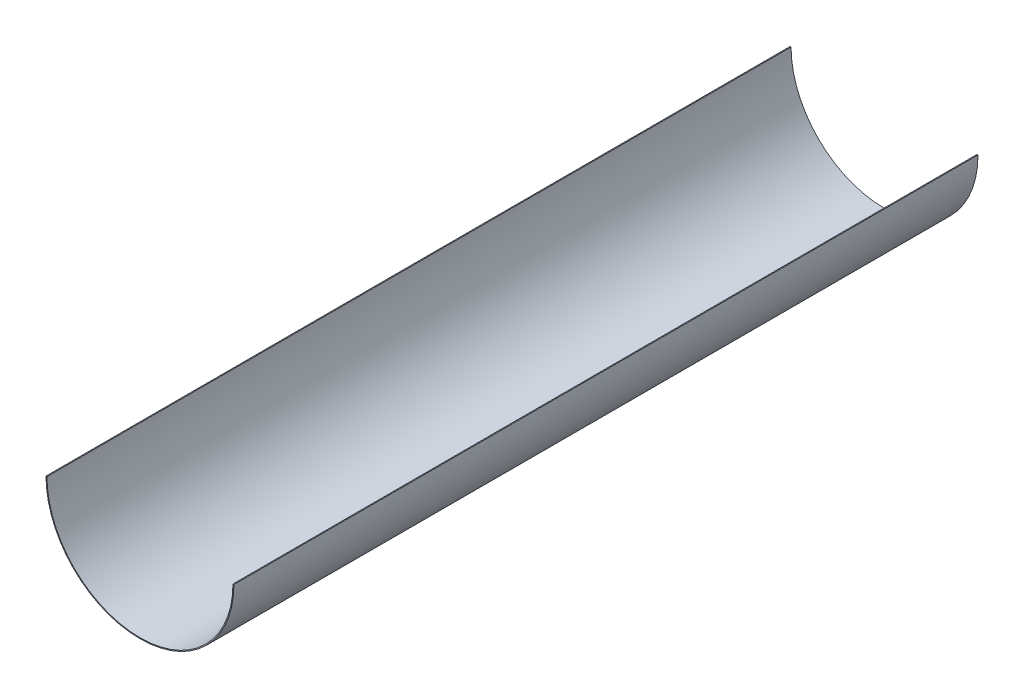
from build123d import *

# Parameters (mm, degrees)
EXTRUDE_1_DEPTH = 8000


with BuildPart() as part:
    # Эскиз2 → Бобышка-Вытянуть1 (new body)
    with BuildSketch(Plane.XY):
        with BuildLine():
            Line((-1010, 0), (-1000, 0))
            ThreePointArc((-1000, 0), (0, -1000), (1000, 0))
            Line((1000, 0), (1010, 0))
            ThreePointArc((1010, 0), (0, -1010), (-1010, 0))
        make_face()
    extrude(amount=EXTRUDE_1_DEPTH)


solid = part.part
